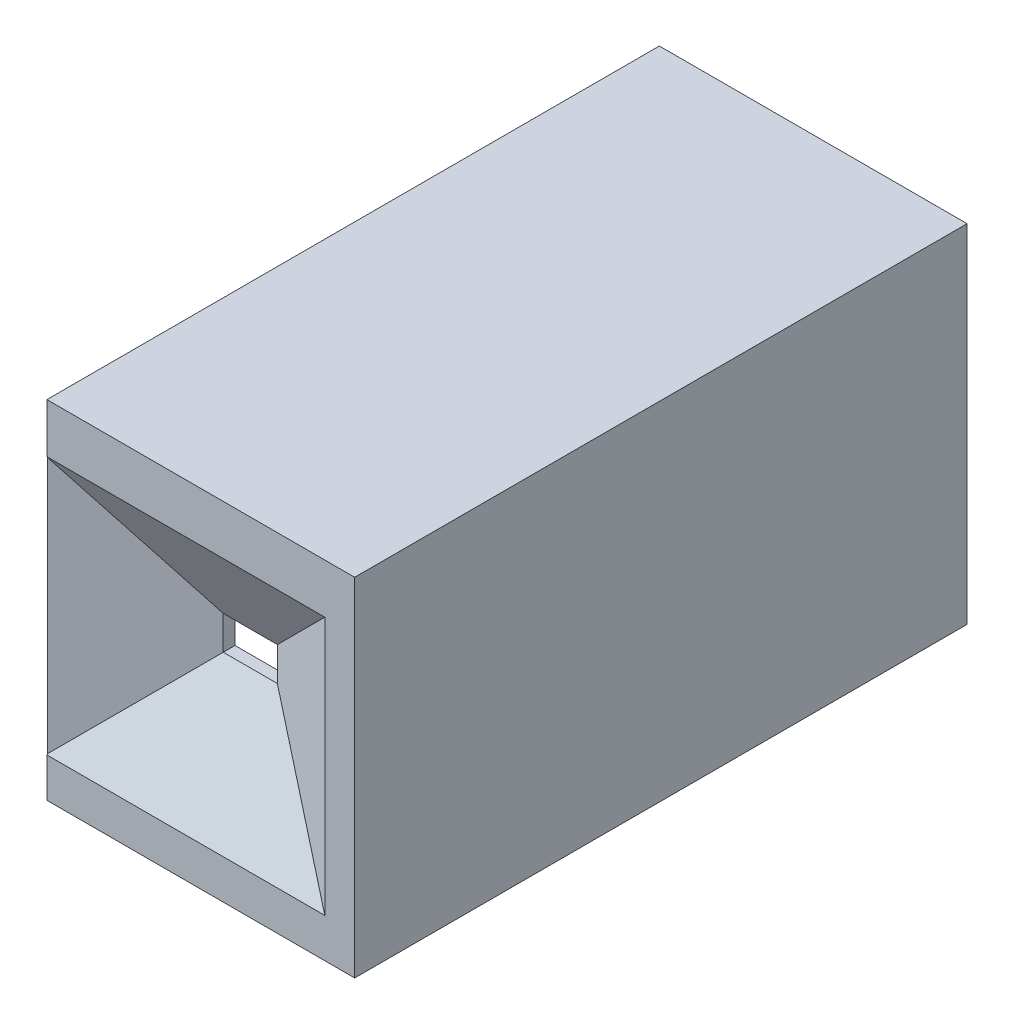
from build123d import *

# Parameters (mm, degrees)
SKETCH2_W           = 33.15
SKETCH2_H           = 33
BOSS_EXTRUDE1_DEPTH = 7.5
SKETCH3_R           = 1.175
CUT_EXTRUDE1_DEPTH  = 4.5
SKETCH4_W           = 5.3
SKETCH4_H           = 7
CUT_EXTRUDE2_DEPTH  = 3.4
SKETCH5_W           = 17.312690108
SKETCH5_H           = 1.808425299
CUT_EXTRUDE3_DEPTH  = 2
SKETCH6_W           = 5.3
SKETCH6_H           = 3.3
CUT_EXTRUDE4_DEPTH  = 25.560753755
CHAMFER3_SIZE       = 11
CHAMFER3_SIZE2      = 6.350852961
SKETCH7_W           = 3
SKETCH7_H           = 33
SKETCH7_H_2         = 30
BOSS_EXTRUDE2_DEPTH = 52.5
SKETCH8_W           = 33.15
SKETCH8_H           = 60
BOSS_EXTRUDE3_DEPTH = 1
SKETCH9_W           = 3
SKETCH9_H           = 34
CUT_EXTRUDE5_DEPTH  = 60
SKETCH10_R          = 0.75
CUT_EXTRUDE6_DEPTH  = 2
SKETCH11_R          = 0.8
CUT_EXTRUDE7_DEPTH  = 2
SKETCH12_R          = 0.8
CUT_EXTRUDE9_DEPTH  = 5.8


with BuildPart() as part:
    # Sketch2 → Boss-Extrude1 (new body)
    with BuildSketch(Plane.XY):
        Rectangle(SKETCH2_W, SKETCH2_H)
    extrude(amount=BOSS_EXTRUDE1_DEPTH)

    # Sketch3 → Cut-Extrude1 (cut)
    with BuildSketch(Plane.XY):
        with Locations((10.325, 10.25)):
            Circle(SKETCH3_R)
        with Locations((-10.325, 10.25)):
            Circle(SKETCH3_R)
        with Locations((10.325, -10.25)):
            Circle(SKETCH3_R)
        with Locations((-10.325, -10.25)):
            Circle(SKETCH3_R)
    extrude(amount=CUT_EXTRUDE1_DEPTH, mode=Mode.SUBTRACT)

    # Sketch4 → Cut-Extrude2 (cut)
    with BuildSketch(Plane.XY):
        with Locations((9.775, 0)):
            Rectangle(SKETCH4_W, SKETCH4_H)
        with Locations((-9.775, 0)):
            Rectangle(SKETCH4_W, SKETCH4_H)
    extrude(amount=CUT_EXTRUDE2_DEPTH, mode=Mode.SUBTRACT)

    # Sketch5 → Cut-Extrude3 (cut)
    with BuildSketch(Plane.XY):
        with Locations((-0.109621432, -11.80915301)):
            Rectangle(SKETCH5_W, SKETCH5_H)
    extrude(amount=CUT_EXTRUDE3_DEPTH, mode=Mode.SUBTRACT)

    # Sketch6 → Cut-Extrude4 (cut, through all)
    with BuildSketch(Plane.XY):
        Rectangle(SKETCH6_W, SKETCH6_H)
    extrude(amount=CUT_EXTRUDE4_DEPTH, mode=Mode.SUBTRACT)

    # Chamfer3
    chamfer3_edges = [part.edges().sort_by_distance(p)[0] for p in [
        (2.65, 0, 7.5),
        (0, 1.65, 7.5),
        (-2.65, 0, 7.5),
        (0, -1.65, 7.5),
    ]]
    chamfer3_side = [part.faces().sort_by_distance(p)[0] for p in [
        (-16.107247662, 0, 7.5),
    ]]
    chamfer(chamfer3_edges, length=CHAMFER3_SIZE, length2=CHAMFER3_SIZE2, reference=chamfer3_side[0])

    # Sketch7 → Boss-Extrude2 (add)
    with BuildSketch(Plane.XY):
        with Locations((15.075, 0)):
            Rectangle(SKETCH7_W, SKETCH7_H)
        Polygon((-13.575, 13.5), (13.575, 13.5), (13.575, 16.5), (-16.575, 16.5), (-16.575, 13.5), align=None)
        with Locations((-15.075, -1.5)):
            Rectangle(SKETCH7_W, SKETCH7_H_2)
    extrude(amount=-BOSS_EXTRUDE2_DEPTH)

    # Sketch8 → Boss-Extrude3 (add)
    with BuildSketch(Plane(origin=(0, 16.5, 0), x_dir=(1, 0, 0), z_dir=(0, 1, 0))):
        with Locations((0, 22.5)):
            Rectangle(SKETCH8_W, SKETCH8_H)
    extrude(amount=BOSS_EXTRUDE3_DEPTH)

    # Sketch9 → Cut-Extrude5 (cut)
    with BuildSketch(Plane(origin=(0, 0, -52.5), x_dir=(-1, 0, 0), z_dir=(0, 0, -1))):
        with Locations((15.075, 0.5)):
            Rectangle(SKETCH9_W, SKETCH9_H)
    extrude(amount=-CUT_EXTRUDE5_DEPTH, mode=Mode.SUBTRACT)

    # Sketch10 → Cut-Extrude6 (cut)
    with BuildSketch(Plane.ZY.offset(13.575)):
        with Locations((-50, 15.5)):
            Circle(SKETCH10_R)
        with Locations(Location((5, 15.5, 0), (0, 0, 180))):
            Circle(SKETCH10_R)
        with Locations((5, -14.5)):
            Circle(SKETCH10_R)
    extrude(amount=-CUT_EXTRUDE6_DEPTH, mode=Mode.SUBTRACT)

    # Sketch11 → Cut-Extrude7 (cut)
    with BuildSketch(Plane(origin=(0, -16.5, 0), x_dir=(-1, 0, 0), z_dir=(0, -1, 0))):
        with Locations(Location((-15.075, 49.5, 0), (0, 0, 90))):
            Circle(SKETCH11_R)
        with Locations(Location((-15.075, -4.5, 0), (0, 0, 270))):
            Circle(SKETCH11_R)
        with Locations(Location((12.075, -4.5, 0), (0, 0, 90))):
            Circle(SKETCH11_R)
    extrude(amount=-CUT_EXTRUDE7_DEPTH, mode=Mode.SUBTRACT)

    # Sketch12 → Cut-Extrude9 (cut)
    with BuildSketch(Plane(origin=(0, 0, -52.5), x_dir=(-1, 0, 0), z_dir=(0, 0, -1))):
        with Locations((-14.575, 15.5)):
            Circle(SKETCH12_R)
        with Locations((-15.075, -14.5)):
            Circle(SKETCH12_R)
    extrude(amount=-CUT_EXTRUDE9_DEPTH, mode=Mode.SUBTRACT)


solid = part.part
